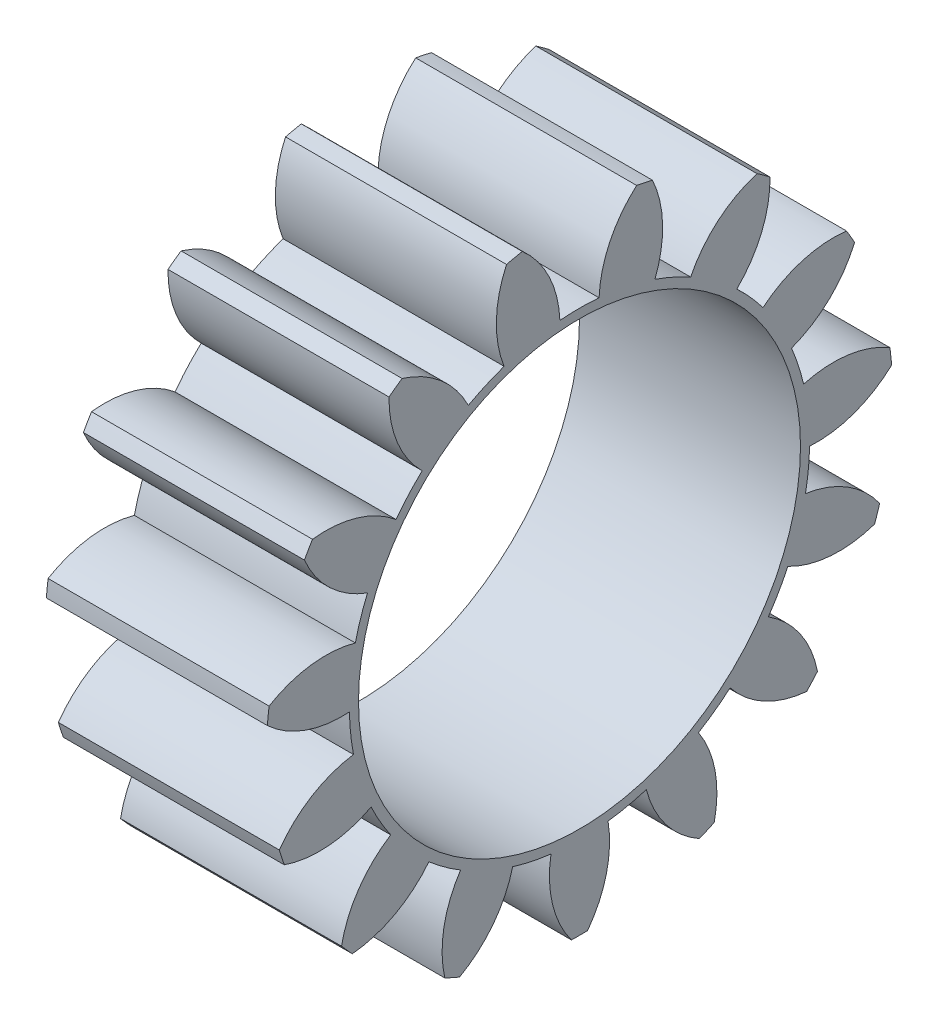
from build123d import *

# Parameters (mm, degrees)
BASPROSKE_W     = 3
BASPROSKE_H     = 4.25
TOOTHCUT_DEPTH  = 7.717514421
TEETHCUTS_COUNT = 15
TEETHCUTS_ANGLE = 336
BORSKE_R        = 3
BORE_DEPTH      = 50.0000508


with BuildPart() as part:
    # BasProSke → Base-Revolve (revolve)
    with BuildSketch(Plane(origin=(0, 0, 0), x_dir=(1, 0, 0), z_dir=(0, 1, 0)), mode=Mode.PRIVATE) as base_revolve_sk:
        with Locations((1.5, 2.125)):
            Rectangle(BASPROSKE_W, BASPROSKE_H)
    revolve(base_revolve_sk.sketch.rotate(Axis((-10, 0, 0), (1, 0, 0)), 180), axis=Axis((-10, 0, 0), (1, 0, 0)))

    # TooCutSke → ToothCut (cut, through all)
    with BuildSketch(Plane(origin=(0, 0, 0), x_dir=(0, 0, -1), z_dir=(1, 0, 0))):
        with BuildLine():
            ThreePointArc((0.265767165, 3.112674704), (0, 3.124), (-0.265767165, 3.112674704))
            ThreePointArc((-0.265767165, 3.112674704), (-0.418628877, 3.712626775), (-0.800767345, 4.19974009))
            ThreePointArc((-0.800767345, 4.19974009), (0, 4.2754), (0.800767345, 4.19974009))
            ThreePointArc((0.800767345, 4.19974009), (0.418628877, 3.712626775), (0.265767165, 3.112674704))
        make_face()
    toothcut = extrude(amount=TOOTHCUT_DEPTH, mode=Mode.SUBTRACT)

    # TeethCuts: ToothCut ×15 about axis
    teethcuts_axis = Axis((-10, 0, 0), (1, 0, 0))
    for i in range(1, TEETHCUTS_COUNT):
        add(toothcut.rotate(teethcuts_axis, i * TEETHCUTS_ANGLE / (TEETHCUTS_COUNT - 1)), mode=Mode.SUBTRACT)

    # BorSke → Bore (cut, symmetric)
    with BuildSketch(Plane(origin=(0, 0, 0), x_dir=(0, 0, -1), z_dir=(1, 0, 0))):
        with Locations(Location((0, 0, 0), (0, 0, 180))):
            Circle(BORSKE_R)
    extrude(amount=BORE_DEPTH, both=True, mode=Mode.SUBTRACT)


solid = part.part
